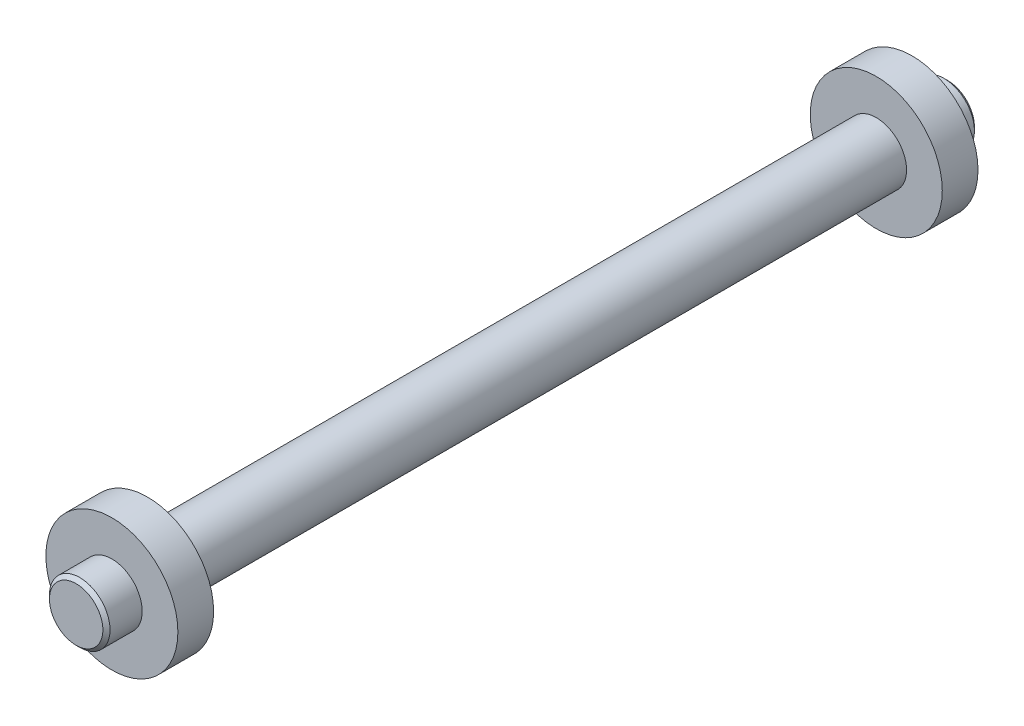
from build123d import *

# Parameters (mm, degrees)
CHAMFER_1_SIZE = 0.125


with BuildPart() as part:
    # 草图2 → 旋转1 (revolve)
    with BuildSketch(Plane(origin=(0, 0, 0), x_dir=(0, 0, -1), z_dir=(1, 0, 0))):
        Polygon((-15.25, 0), (15.25, 0), (15.25, 1.06), (14, 1.06), (14, 2.31), (12.75, 2.31), (12.75, 1.06), (-12.75, 1.06), (-12.75, 2.31), (-14, 2.31), (-14, 1.06), (-15.25, 1.06), align=None)
    revolve(axis=Axis((0, 0, 15.25), (0, 0, -1)))

    # 倒角1
    chamfer_1_edges = [part.edges().sort_by_distance(p)[0] for p in [
        (0, -1.06, -15.25),
        (0, -1.06, 15.25),
    ]]
    chamfer(chamfer_1_edges, length=CHAMFER_1_SIZE)


solid = part.part
